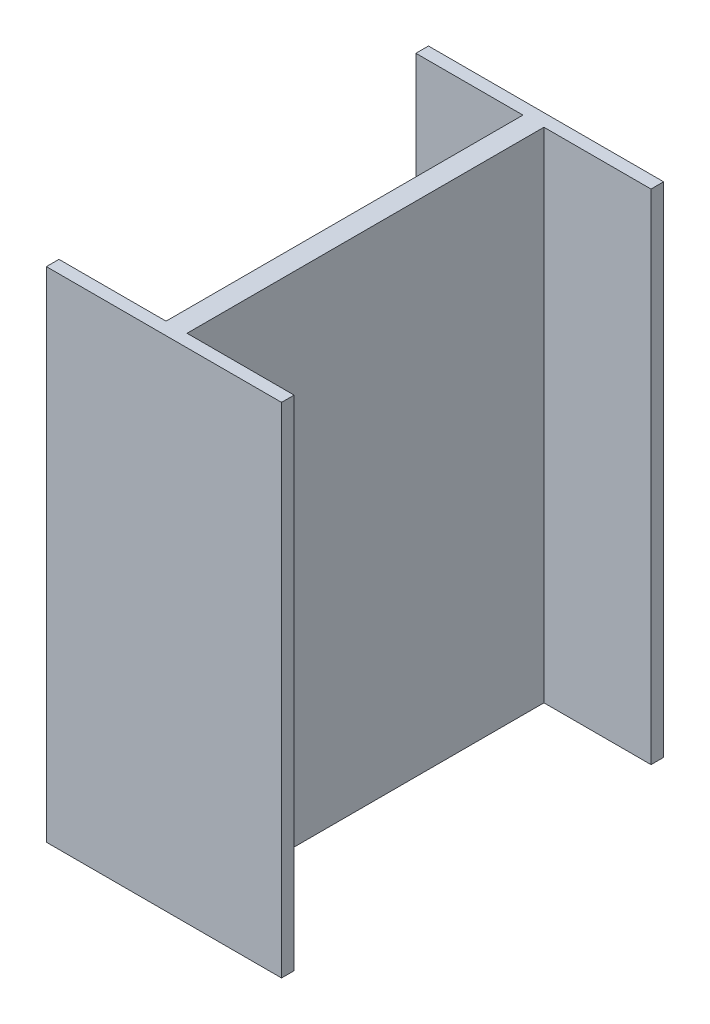
from build123d import *

# Parameters (mm, degrees)
BOSS_EXTRUDE2_DEPTH = 1187.25


with BuildPart() as part:
    # Sketch1 → Boss-Extrude2 (new body)
    with BuildSketch(Plane(origin=(0, 0, 0), x_dir=(1, 0, 0), z_dir=(0, 1, 0))):
        Polygon((-37.5, 455), (37.5, 455), (280.014880557, 455), (280.014880557, 425), (25, 425), (25, -425), (280.014880557, -425), (280.014880557, -455), (37.5, -455), (-37.5, -455), (-280.014880557, -455), (-280.014880557, -425), (-25, -425), (-25, 425), (-280.014880557, 425), (-280.014880557, 455), align=None)
    extrude(amount=BOSS_EXTRUDE2_DEPTH)


solid = part.part
